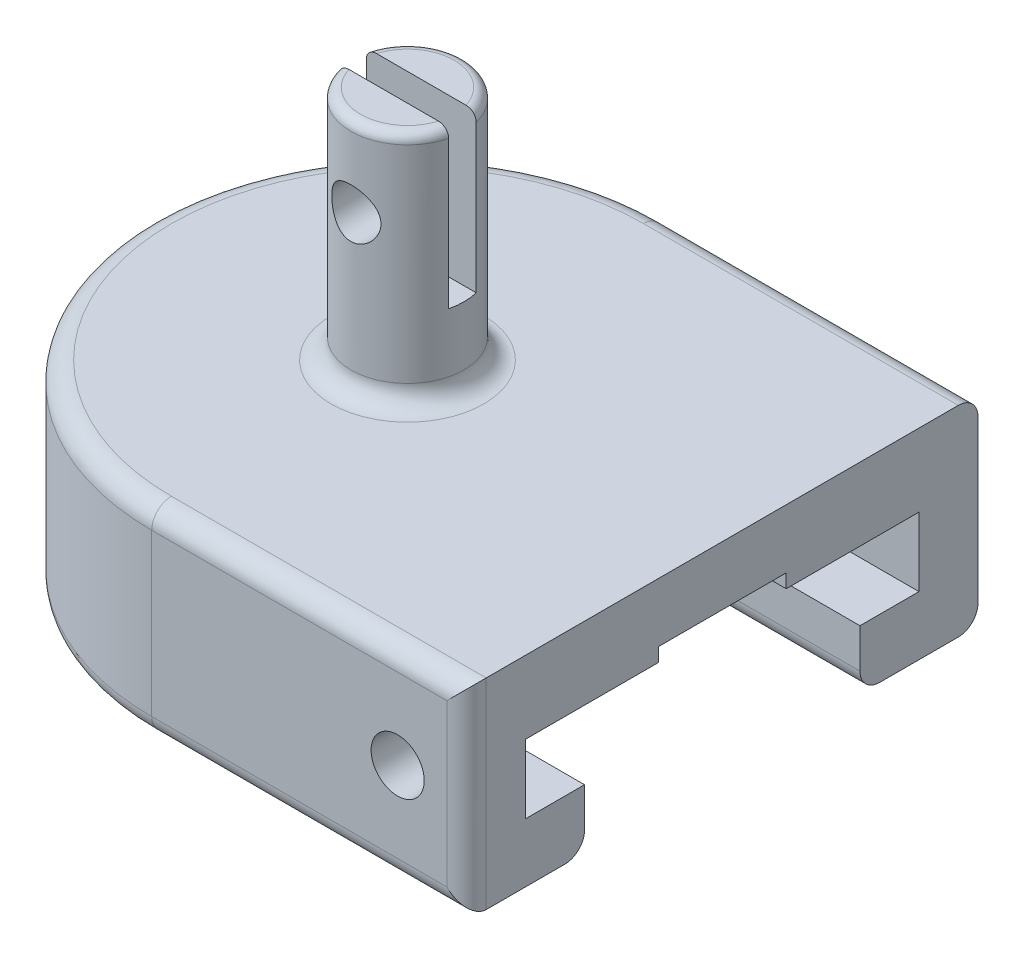
from build123d import *

# Parameters (mm, degrees)
BOSS_EXTRUDE1_DEPTH   = 3
BOSS_EXTRUDE2_DEPTH   = 3.5
BOSS_EXTRUDE3_DEPTH   = 3.7
SKETCH4_R             = 2.88
BOSS_EXTRUDE4_DEPTH   = 12
SKETCH11_W            = 6.5
SKETCH11_H            = 0.7
CUT_EXTRUDE3_DEPTH    = 23
F_2_5MM_DOWEL_HOLE1_D = 2.5
SKETCH8_R             = 1.35
CUT_EXTRUDE1_DEPTH    = 38.747052924
FILLET1_R             = 1
FILLET2_R             = 1
CUT_EXTRUDE2_START    = -8
CUT_EXTRUDE2_DEPTH    = 8
FILLET3_R             = 0.5


with BuildPart() as part:
    # Sketch1 → Boss-Extrude1 (new body)
    with BuildSketch(Plane(origin=(0, 0, 0), x_dir=(1, 0, 0), z_dir=(0, 1, 0))):
        with BuildLine():
            Line((0, 13), (16, 13))
            Line((16, 13), (16, 7))
            Line((16, 7), (0, 7))
            ThreePointArc((0, 7), (-7, 0), (0, -7))
            Line((0, -7), (16, -7))
            Line((16, -7), (16, -13))
            Line((16, -13), (0, -13))
            ThreePointArc((0, -13), (-13, 0), (0, 13))
        make_face()
    extrude(amount=BOSS_EXTRUDE1_DEPTH)

    # Sketch2 → Boss-Extrude2 (add)
    with BuildSketch(Plane(origin=(0, 3, 0), x_dir=(1, 0, 0), z_dir=(0, 1, 0))):
        with BuildLine():
            Line((0, 13), (16, 13))
            Line((16, 13), (16, 10))
            Line((16, 10), (0, 10))
            ThreePointArc((0, 10), (-10, 0), (0, -10))
            Line((0, -10), (16, -10))
            Line((16, -10), (16, -13))
            Line((16, -13), (0, -13))
            ThreePointArc((0, -13), (-13, 0), (0, 13))
        make_face()
    extrude(amount=BOSS_EXTRUDE2_DEPTH)

    # Sketch3 → Boss-Extrude3 (add)
    with BuildSketch(Plane(origin=(0, 6.5, 0), x_dir=(1, 0, 0), z_dir=(0, 1, 0))):
        with BuildLine():
            Line((16, 13), (0, 13))
            ThreePointArc((0, 13), (-13, 0), (0, -13))
            Line((0, -13), (16, -13))
            Line((16, -13), (16, -7))
            Line((16, -7), (16, 7))
            Line((16, 7), (16, 13))
        make_face()
    extrude(amount=BOSS_EXTRUDE3_DEPTH)

    # Sketch4 → Boss-Extrude4 (add)
    with BuildSketch(Plane(origin=(0, 10.2, 0), x_dir=(1, 0, 0), z_dir=(0, 1, 0))):
        with Locations(Location((0, 0, 0), (0, 0, 270))):
            Circle(SKETCH4_R)
    extrude(amount=BOSS_EXTRUDE4_DEPTH)

    # Sketch11 → Cut-Extrude3 (cut)
    with BuildSketch(Plane(origin=(16, 0, 0), x_dir=(0, 0, -1), z_dir=(1, 0, 0))):
        with Locations((0, 6.85)):
            Rectangle(SKETCH11_W, SKETCH11_H)
    extrude(amount=-CUT_EXTRUDE3_DEPTH, mode=Mode.SUBTRACT)

    # Ø2.5mm Dowel Hole1 (through all)
    with Locations(Plane(origin=(-0.002429038, 18.104937254, 2.879998976), x_dir=(0.999999644325, 0, 0.000843415861), z_dir=(-0.000843415861, 0, 0.999999644325))):
        with Locations((0, 0)):
            Hole(F_2_5MM_DOWEL_HOLE1_D / 2)

    # Sketch8 → Cut-Extrude1 (cut, through all)
    with BuildSketch(Plane.XY.offset(13)):
        with Locations((12.5, 5.1)):
            Circle(SKETCH8_R)
    extrude(amount=-CUT_EXTRUDE1_DEPTH, mode=Mode.SUBTRACT)

    # Fillet1
    fillet1_edges = [part.edges().sort_by_distance(p)[0] for p in [
        (8, 0, -13),
        (8, 0, -7),
        (-7, 0, 0),
        (16, 5.1, 13),
        (-13, 10.2, 0),
        (8, 10.2, 13),
        (8, 10.2, -13),
        (8, 0, 7),
        (8, 0, 13),
        (-13, 0, 0),
    ]]
    fillet(fillet1_edges, radius=FILLET1_R)

    # Fillet2
    fillet2_edges = [part.edges().sort_by_distance(p)[0] for p in [
        (0, 10.2, -2.88),
    ]]
    fillet(fillet2_edges, radius=FILLET2_R)

    # Sketch10 → Cut-Extrude2 (cut)
    with BuildSketch(Plane(origin=(0, 22.2, 0), x_dir=(1, 0, 0), z_dir=(0, 1, 0)).offset(CUT_EXTRUDE2_START)):
        with BuildLine():
            Line((-2.793635624, 0.7), (2.793635624, 0.7))
            ThreePointArc((2.793635624, 0.7), (2.88, 0), (2.793635624, -0.7))
            Line((2.793635624, -0.7), (-2.793635624, -0.7))
            ThreePointArc((-2.793635624, -0.7), (-2.88, 0), (-2.793635624, 0.7))
        make_face()
    extrude(amount=CUT_EXTRUDE2_DEPTH, mode=Mode.SUBTRACT)

    # Fillet3
    fillet3_edges = [part.edges().sort_by_distance(p)[0] for p in [
        (0, 22.2, -2.88),
        (1.771778767, 22.2, 2.270506551),
    ]]
    fillet(fillet3_edges, radius=FILLET3_R)


solid = part.part
